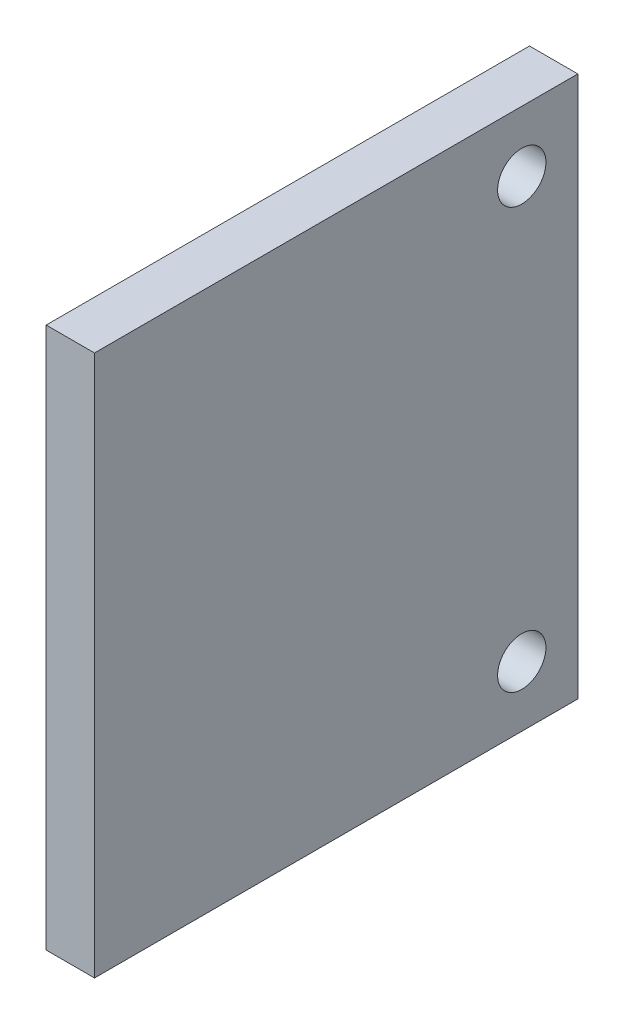
from build123d import *

# Parameters (mm, degrees)
IZIM1_W                     = 28
IZIM1_H                     = 25
IZIM1_R                     = 1.25
Y_KSEKLIK_EKSTR_ZYON1_DEPTH = 2.5


with BuildPart() as part:
    # Çizim1 → Yükseklik-Ekstrüzyon1 (new body)
    with BuildSketch(Plane.YZ):
        with Locations((0, 9.6)):
            Rectangle(IZIM1_W, IZIM1_H)
        with Locations(Location((-10.87, 0, 0), (0, 0, 270))):
            Circle(IZIM1_R, mode=Mode.SUBTRACT)
        with Locations(Location((10.87, 0, 0), (0, 0, 270))):
            Circle(IZIM1_R, mode=Mode.SUBTRACT)
    extrude(amount=Y_KSEKLIK_EKSTR_ZYON1_DEPTH)


solid = part.part
